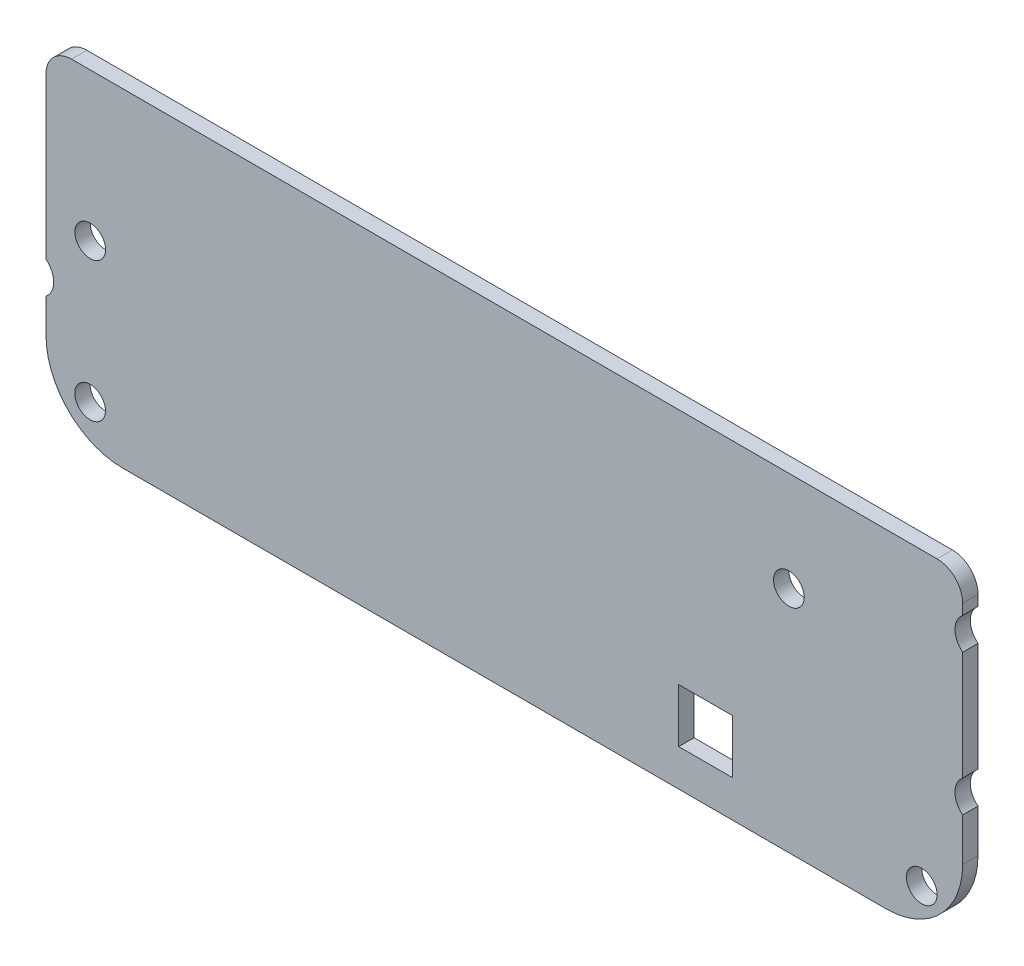
from build123d import *

# Parameters (mm, degrees)
BOSS_EXTRU_1_DEPTH      = 3
ESQUISSE2_R             = 3
ENL_V_MAT_EXTRU_1_DEPTH = 10
ESQUISSE7_R             = 4
ENL_V_MAT_EXTRU_2_DEPTH = 10
ESQUISSE8_W             = 10.5
ESQUISSE8_H             = 10.5
ENL_V_MAT_EXTRU_3_DEPTH = 10


with BuildPart() as part:
    # Esquisse1 → Boss.-Extru.1 (new body)
    with BuildSketch(Plane.XY):
        with BuildLine():
            Line((118.101682981, 78.402253408), (267.271682981, 78.402253408))
            ThreePointArc((267.271682981, 78.402253408), (277.878284699, 82.795651691), (282.271682981, 93.402253408))
            Line((282.271682981, 93.402253408), (282.271682981, 137.632253408))
            ThreePointArc((282.271682981, 137.632253408), (280.807216887, 141.167787314), (277.271682981, 142.632253408))
            Line((277.271682981, 142.632253408), (108.101682981, 142.632253408))
            ThreePointArc((108.101682981, 142.632253408), (104.566149075, 141.167787314), (103.101682981, 137.632253408))
            Line((103.101682981, 137.632253408), (103.101682981, 93.402253408))
            ThreePointArc((103.101682981, 93.402253408), (107.495081263, 82.795651691), (118.101682981, 78.402253408))
        make_face()
    extrude(amount=BOSS_EXTRU_1_DEPTH)

    # Esquisse2 → Enlèv. mat.-Extru.1 (cut)
    with BuildSketch(Plane(origin=(0, 0, 0), x_dir=(-1, 0, 0), z_dir=(0, 0, -1))):
        with Locations((-111.741682981, 113.692253408)):
            Circle(ESQUISSE2_R)
        with Locations((-111.721682981, 86.402253408)):
            Circle(ESQUISSE2_R)
        with Locations((-248.301682981, 123.122253408)):
            Circle(ESQUISSE2_R)
        with Locations((-274.271682981, 85.752253408)):
            Circle(ESQUISSE2_R)
    extrude(amount=-ENL_V_MAT_EXTRU_1_DEPTH, mode=Mode.SUBTRACT)

    # Esquisse7 → Enlèv. mat.-Extru.2 (cut)
    with BuildSketch(Plane.XY.offset(3)):
        with Locations((100.601682981, 103.122253408)):
            Circle(ESQUISSE7_R)
        with Locations((284.771682981, 104.902253408)):
            Circle(ESQUISSE7_R)
        with Locations((284.771682981, 132.442253408)):
            Circle(ESQUISSE7_R)
    extrude(amount=-ENL_V_MAT_EXTRU_2_DEPTH, mode=Mode.SUBTRACT)

    # Esquisse8 → Enlèv. mat.-Extru.3 (cut)
    with BuildSketch(Plane(origin=(0, 0, 0), x_dir=(-1, 0, 0), z_dir=(0, 0, -1))):
        with Locations((-232.021682981, 90.852253408)):
            Rectangle(ESQUISSE8_W, ESQUISSE8_H)
    extrude(amount=-ENL_V_MAT_EXTRU_3_DEPTH, mode=Mode.SUBTRACT)


solid = part.part
